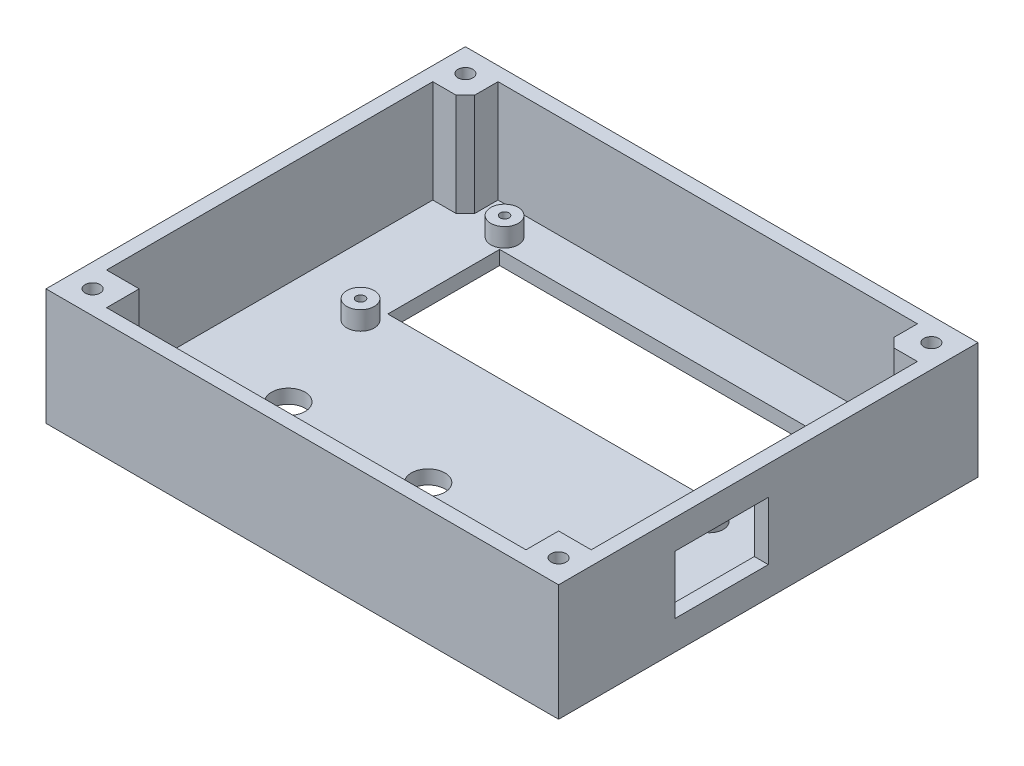
from build123d import *

# Parameters (mm, degrees)
CROQUIS1_W              = 110
CROQUIS1_H              = 90
SALIENTE_EXTRUIR1_DEPTH = 25
VACIADO1_T              = -3
CROQUIS2_W              = 71.3
CROQUIS2_H              = 24
CORTAR_EXTRUIR1_DEPTH   = 75.390859654
CROQUIS4_R              = 2.95
CROQUIS4_R_2            = 1.45
SALIENTE_EXTRUIR2_DEPTH = 4
SALIENTE_EXTRUIR3_REACH = 75.308
CROQUIS5_R              = 1.45
CROQUIS5_R_2            = 0.95
MATRIZL1_COUNT          = 2
MATRIZL1_PITCH          = 74.9
MATRIZL1_COUNT_DIR2     = 2
MATRIZL1_PITCH_DIR2     = 30.9
SALIENTE_EXTRUIR4_REACH = 77.333
CROQUIS6_W              = 10
CROQUIS6_H              = 10
CROQUIS7_R              = 1.6
CORTAR_EXTRUIR2_DEPTH   = 76.332595867
CROQUIS8_R              = 3.1
CORTAR_EXTRUIR3_DEPTH   = 4
CHAFL_N1_SIZE           = 2
CROQUIS10_R             = 3.6
CORTAR_EXTRUIR5_DEPTH   = 76.332595867
CROQUIS11_W             = 20
CROQUIS11_H             = 12.5
CORTAR_EXTRUIR6_DEPTH   = 10


with BuildPart() as part:
    # Croquis1 → Saliente-Extruir1 (new body)
    with BuildSketch(Plane(origin=(0, 0, 0), x_dir=(1, 0, 0), z_dir=(0, 1, 0))):
        Rectangle(CROQUIS1_W, CROQUIS1_H)
    extrude(amount=SALIENTE_EXTRUIR1_DEPTH)

    # Vaciado1
    vaciado1_openings = [part.faces().sort_by_distance(p)[0] for p in [
        (0, 25, 0),
    ]]
    offset(amount=VACIADO1_T, openings=vaciado1_openings, kind=Kind.INTERSECTION)

    # Croquis2 → Cortar-Extruir1 (cut, through all)
    with BuildSketch(Plane(origin=(0, 3, 0), x_dir=(1, 0, 0), z_dir=(0, 1, 0))):
        with Locations((0, 21)):
            Rectangle(CROQUIS2_W, CROQUIS2_H)
    extrude(amount=-CORTAR_EXTRUIR1_DEPTH, mode=Mode.SUBTRACT)

    # Croquis4 → Saliente-Extruir2 (add)
    # profile 1 of 4: a face of its own
    with BuildSketch(Plane(origin=(0, 3, 0), x_dir=(1, 0, 0), z_dir=(0, 1, 0))):
        with Locations(Location((-37.45, 35.85, 0), (0, 0, 90))):
            Circle(CROQUIS4_R)
        with Locations(Location((-37.45, 35.85, 0), (0, 0, 270))):
            Circle(CROQUIS4_R_2, mode=Mode.SUBTRACT)
    # profile 2 of 4: a face of its own
    with BuildSketch(Plane(origin=(0, 3, 0), x_dir=(1, 0, 0), z_dir=(0, 1, 0))):
        with Locations(Location((-37.45, 4.95, 0), (0, 0, 90))):
            Circle(CROQUIS4_R)
        with Locations(Location((-37.45, 4.95, 0), (0, 0, 270))):
            Circle(CROQUIS4_R_2, mode=Mode.SUBTRACT)
    # profile 3 of 4: a face of its own
    with BuildSketch(Plane(origin=(0, 3, 0), x_dir=(1, 0, 0), z_dir=(0, 1, 0))):
        with Locations(Location((37.45, 35.85, 0), (0, 0, 90))):
            Circle(CROQUIS4_R)
        with Locations(Location((37.45, 35.85, 0), (0, 0, 270))):
            Circle(CROQUIS4_R_2, mode=Mode.SUBTRACT)
    # profile 4 of 4: a face of its own
    with BuildSketch(Plane(origin=(0, 3, 0), x_dir=(1, 0, 0), z_dir=(0, 1, 0))):
        with Locations(Location((37.45, 4.95, 0), (0, 0, 90))):
            Circle(CROQUIS4_R)
        with Locations(Location((37.45, 4.95, 0), (0, 0, 270))):
            Circle(CROQUIS4_R_2, mode=Mode.SUBTRACT)
    extrude(amount=SALIENTE_EXTRUIR2_DEPTH)

    # Croquis5 → Saliente-Extruir3 (add, up to next)
    with BuildSketch(Plane(origin=(0, 7, 0), x_dir=(1, 0, 0), z_dir=(0, 1, 0)), mode=Mode.PRIVATE) as saliente_extruir3_sk1:
        with Locations((-37.45, 35.85)):
            Circle(CROQUIS5_R)
        with Locations(Location((-37.45, 35.85, 0), (0, 0, 270))):
            Circle(CROQUIS5_R_2, mode=Mode.SUBTRACT)
    saliente_extruir3_tool1 = extrude(saliente_extruir3_sk1.sketch, amount=-SALIENTE_EXTRUIR3_REACH, mode=Mode.PRIVATE) - part.part
    saliente_extruir3 = saliente_extruir3_tool1.solids().sort_by_distance((-38.858988, 7, -35.85))[0]
    add(saliente_extruir3)

    # MatrizL1: Saliente-Extruir3 2 × 2
    with Locations(*[(i * MATRIZL1_PITCH, 0, j * MATRIZL1_PITCH_DIR2) for i in range(MATRIZL1_COUNT) for j in range(MATRIZL1_COUNT_DIR2) if (i, j) != (0, 0)]):
        add(saliente_extruir3)

    # Croquis6 → Saliente-Extruir4 (add, up to next)
    with BuildSketch(Plane(origin=(0, 25, 0), x_dir=(1, 0, 0), z_dir=(0, 1, 0)), mode=Mode.PRIVATE) as saliente_extruir4_sk1:
        with Locations((-50, 40)):
            Rectangle(CROQUIS6_W, CROQUIS6_H)
    saliente_extruir4_tool1 = extrude(saliente_extruir4_sk1.sketch, amount=-SALIENTE_EXTRUIR4_REACH, mode=Mode.PRIVATE) - part.part
    # Croquis6 → Saliente-Extruir4 (add, up to next)
    with BuildSketch(Plane(origin=(0, 25, 0), x_dir=(1, 0, 0), z_dir=(0, 1, 0)), mode=Mode.PRIVATE) as saliente_extruir4_sk2:
        with Locations((-50, -40)):
            Rectangle(CROQUIS6_W, CROQUIS6_H)
    saliente_extruir4_tool2 = extrude(saliente_extruir4_sk2.sketch, amount=-SALIENTE_EXTRUIR4_REACH, mode=Mode.PRIVATE) - part.part
    # Croquis6 → Saliente-Extruir4 (add, up to next)
    with BuildSketch(Plane(origin=(0, 25, 0), x_dir=(1, 0, 0), z_dir=(0, 1, 0)), mode=Mode.PRIVATE) as saliente_extruir4_sk3:
        with Locations((50, -40)):
            Rectangle(CROQUIS6_W, CROQUIS6_H)
    saliente_extruir4_tool3 = extrude(saliente_extruir4_sk3.sketch, amount=-SALIENTE_EXTRUIR4_REACH, mode=Mode.PRIVATE) - part.part
    # Croquis6 → Saliente-Extruir4 (add, up to next)
    with BuildSketch(Plane(origin=(0, 25, 0), x_dir=(1, 0, 0), z_dir=(0, 1, 0)), mode=Mode.PRIVATE) as saliente_extruir4_sk4:
        with Locations((50, 40)):
            Rectangle(CROQUIS6_W, CROQUIS6_H)
    saliente_extruir4_tool4 = extrude(saliente_extruir4_sk4.sketch, amount=-SALIENTE_EXTRUIR4_REACH, mode=Mode.PRIVATE) - part.part
    add(saliente_extruir4_tool1.solids().sort_by_distance((-50, 25, -40))[0])
    add(saliente_extruir4_tool2.solids().sort_by_distance((-50, 25, 40))[0])
    add(saliente_extruir4_tool3.solids().sort_by_distance((50, 25, 40))[0])
    add(saliente_extruir4_tool4.solids().sort_by_distance((50, 25, -40))[0])

    # Croquis7 → Cortar-Extruir2 (cut, through all)
    with BuildSketch(Plane(origin=(0, 25, 0), x_dir=(1, 0, 0), z_dir=(0, 1, 0))):
        with Locations(Location((-50, -40, 0), (0, 0, 270))):
            Circle(CROQUIS7_R)
        with Locations(Location((50, -40, 0), (0, 0, 270))):
            Circle(CROQUIS7_R)
        with Locations(Location((50, 40, 0), (0, 0, 270))):
            Circle(CROQUIS7_R)
        with Locations(Location((-50, 40, 0), (0, 0, 270))):
            Circle(CROQUIS7_R)
    extrude(amount=-CORTAR_EXTRUIR2_DEPTH, mode=Mode.SUBTRACT)

    # Croquis8 → Cortar-Extruir3 (cut)
    with BuildSketch(Plane.XZ):
        with Locations(Location((50, -40, 0), (0, 0, 270))):
            Circle(CROQUIS8_R)
        with Locations(Location((-50, -40, 0), (0, 0, 270))):
            Circle(CROQUIS8_R)
        with Locations(Location((-50, 40, 0), (0, 0, 270))):
            Circle(CROQUIS8_R)
        with Locations(Location((50, 40, 0), (0, 0, 270))):
            Circle(CROQUIS8_R)
    extrude(amount=-CORTAR_EXTRUIR3_DEPTH, mode=Mode.SUBTRACT)

    # Chaflán1
    chafl_n1_edges = [part.edges().sort_by_distance(p)[0] for p in [
        (-45, 14, -35),
        (45, 14, -35),
    ]]
    chamfer(chafl_n1_edges, length=CHAFL_N1_SIZE)

    # Croquis10 → Cortar-Extruir5 (cut, through all)
    with BuildSketch(Plane.XZ):
        with Locations(Location((0, 18, 0), (0, 0, 270))):
            Circle(CROQUIS10_R)
        with Locations(Location((30, 18, 0), (0, 0, 270))):
            Circle(CROQUIS10_R)
        with Locations(Location((-30, 18, 0), (0, 0, 270))):
            Circle(CROQUIS10_R)
    extrude(amount=-CORTAR_EXTRUIR5_DEPTH, mode=Mode.SUBTRACT)

    # Croquis11 → Cortar-Extruir6 (cut)
    with BuildSketch(Plane(origin=(55, 0, 0), x_dir=(0, 0, -1), z_dir=(1, 0, 0))):
        with Locations((-10, 12.5)):
            Rectangle(CROQUIS11_W, CROQUIS11_H)
    extrude(amount=-CORTAR_EXTRUIR6_DEPTH, mode=Mode.SUBTRACT)


solid = part.part
